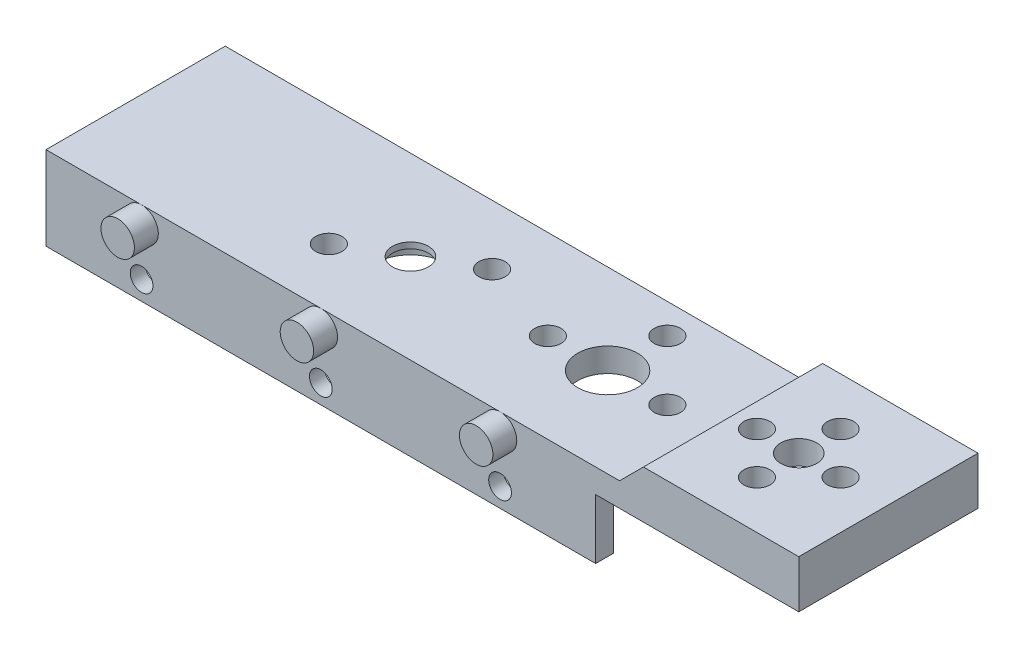
from build123d import *

# Parameters (mm, degrees)
SKETCH_1_W          = 63
SKETCH_1_H          = 15
SKETCH_1_R          = 1.1
SKETCH_1_R_2        = 1.5
SKETCH_1_R_3        = 2.5
EXTRUDE_1_DEPTH     = 2
SKETCH_2_R          = 1.4
EXTRUDE_2_DEPTH     = 2
SKETCH_3_R          = 3
CUT_EXTRUDE_1_DEPTH = 1.5
SKETCH_4_W          = 46
SKETCH_4_H          = 1.5
EXTRUDE_3_DEPTH     = 5
SKETCH_2_3_R        = 0.95
CUT_EXTRUDE_2_DEPTH = 1.5
CUT_EXTRUDE_3_DEPTH = 0.25
SKETCH_1_7_W        = 15
SKETCH_1_7_H        = 15
SKETCH_1_7_R        = 1.5
SKETCH_1_7_R_2      = 1.1
EXTRUDE_4_DEPTH     = 4
SKETCH_1_8_R        = 6
SKETCH_1_8_R_2      = 1.5
SKETCH_1_8_R_3      = 1.1
CUT_EXTRUDE_4_DEPTH = 2
CUT_EXTRUDE_5_DEPTH = 15


with BuildPart() as part:
    # 草图1 → 凸台-拉伸1 (new body)
    with BuildSketch(Plane(origin=(0, 0, 0), x_dir=(1, 0, 0), z_dir=(0, 1, 0))):
        Rectangle(SKETCH_1_W, SKETCH_1_H)
        with Locations(Location((-12.830127019, -2.5, 0), (0, 0, 270))):
            Circle(SKETCH_1_R, mode=Mode.SUBTRACT)
        with Locations(Location((3, 0, 0), (0, 0, 270))):
            Circle(SKETCH_1_R, mode=Mode.SUBTRACT)
        with Locations(Location((-8.5, 0, 0), (0, 0, 270))):
            Circle(SKETCH_1_R_2, mode=Mode.SUBTRACT)
        with Locations(Location((-4.169872981, 2.5, 0), (0, 0, 270))):
            Circle(SKETCH_1_R, mode=Mode.SUBTRACT)
        with Locations(Location((8, 0, 0), (0, 0, 270))):
            Circle(SKETCH_1_R_3, mode=Mode.SUBTRACT)
        with Locations(Location((13, 0, 0), (0, 0, 270))):
            Circle(SKETCH_1_R, mode=Mode.SUBTRACT)
        with Locations(Location((8, 5, 0), (0, 0, 270))):
            Circle(SKETCH_1_R, mode=Mode.SUBTRACT)
        with Locations(Location((24, 3.5, 0), (0, 0, 270))):
            Circle(SKETCH_1_R, mode=Mode.SUBTRACT)
        with Locations(Location((24, -3.5, 0), (0, 0, 270))):
            Circle(SKETCH_1_R, mode=Mode.SUBTRACT)
        with Locations(Location((20.5, 0, 0), (0, 0, 270))):
            Circle(SKETCH_1_R, mode=Mode.SUBTRACT)
        with Locations(Location((24, 0, 0), (0, 0, 270))):
            Circle(SKETCH_1_R_2, mode=Mode.SUBTRACT)
        with Locations(Location((27.5, 0, 0), (0, 0, 270))):
            Circle(SKETCH_1_R, mode=Mode.SUBTRACT)
    extrude(amount=EXTRUDE_1_DEPTH)

    # 草图2 → 凸台-拉伸2 (add)
    with BuildSketch(Plane.XY.offset(7.5)):
        with Locations(Location((-23.5, 0.6, 0), (0, 0, 205.376933525))):
            Circle(SKETCH_2_R)
        with Locations(Location((-8.5, 0.6, 0), (0, 0, 205.376933525))):
            Circle(SKETCH_2_R)
        with Locations(Location((6.5, 0.6, 0), (0, 0, 205.376933525))):
            Circle(SKETCH_2_R)
    extrude(amount=EXTRUDE_2_DEPTH)

    # 草图3 → 切除-拉伸1 (cut)
    with BuildSketch(Plane.XZ):
        with Locations(Location((-8.5, 0, 0), (0, 0, 270))):
            Circle(SKETCH_3_R)
    extrude(amount=-CUT_EXTRUDE_1_DEPTH, mode=Mode.SUBTRACT)

    # 草图4 → 凸台-拉伸3 (add)
    with BuildSketch(Plane.XZ):
        with Locations((-8.5, 6.75)):
            Rectangle(SKETCH_4_W, SKETCH_4_H)
    extrude(amount=EXTRUDE_3_DEPTH)

    # 草图2<3> → 切除-拉伸2 (cut)
    with BuildSketch(Plane.XY.offset(7.5)):
        with Locations((-23.5, -3.4)):
            Circle(SKETCH_2_3_R)
        with Locations((-8.5, -3.4)):
            Circle(SKETCH_2_3_R)
        with Locations((6.5, -3.4)):
            Circle(SKETCH_2_3_R)
    extrude(amount=-CUT_EXTRUDE_2_DEPTH, mode=Mode.SUBTRACT)

    # 草图5 → 切除-拉伸3 (cut)
    with BuildSketch(Plane(origin=(0, 0, 6), x_dir=(-1, 0, 0), z_dir=(0, 0, -1))):
        Polygon((22.403034489, -1.5), (24.596965511, -1.5), (25.693931023, -3.4), (24.596965511, -5.3), (22.403034489, -5.3), (21.306068977, -3.4), align=None)
        Polygon((6.306068977, -3.4), (7.403034489, -1.5), (9.596965511, -1.5), (10.693931023, -3.4), (9.596965511, -5.3), (7.403034489, -5.3), align=None)
        Polygon((-8.693931023, -3.4), (-7.596965511, -1.5), (-5.403034489, -1.5), (-4.306068977, -3.4), (-5.403034489, -5.3), (-7.596965511, -5.3), align=None)
    extrude(amount=-CUT_EXTRUDE_3_DEPTH, mode=Mode.SUBTRACT)

    # 草图1<7> → 凸台-拉伸4 (add)
    with BuildSketch(Plane(origin=(0, 0, 0), x_dir=(1, 0, 0), z_dir=(0, 1, 0))):
        with Locations((24, 0)):
            Rectangle(SKETCH_1_7_W, SKETCH_1_7_H)
        with Locations(Location((24, 0, 0), (0, 0, 270))):
            Circle(SKETCH_1_7_R, mode=Mode.SUBTRACT)
        with Locations(Location((27.5, 0, 0), (0, 0, 270))):
            Circle(SKETCH_1_7_R_2, mode=Mode.SUBTRACT)
        with Locations(Location((24, -3.5, 0), (0, 0, 270))):
            Circle(SKETCH_1_7_R_2, mode=Mode.SUBTRACT)
        with Locations(Location((20.5, 0, 0), (0, 0, 270))):
            Circle(SKETCH_1_7_R_2, mode=Mode.SUBTRACT)
        with Locations(Location((24, 3.5, 0), (0, 0, 270))):
            Circle(SKETCH_1_7_R_2, mode=Mode.SUBTRACT)
    extrude(amount=EXTRUDE_4_DEPTH)

    # 草图1<8> → 切除-拉伸4 (cut)
    with BuildSketch(Plane(origin=(0, 0, 0), x_dir=(1, 0, 0), z_dir=(0, 1, 0))):
        with Locations(Location((24, 0, 0), (0, 0, 270))):
            Circle(SKETCH_1_8_R)
        with Locations(Location((24, 0, 0), (0, 0, 270))):
            Circle(SKETCH_1_8_R_2, mode=Mode.SUBTRACT)
        with Locations(Location((27.5, 0, 0), (0, 0, 270))):
            Circle(SKETCH_1_8_R_3, mode=Mode.SUBTRACT)
        with Locations(Location((24, -3.5, 0), (0, 0, 270))):
            Circle(SKETCH_1_8_R_3, mode=Mode.SUBTRACT)
        with Locations(Location((20.5, 0, 0), (0, 0, 270))):
            Circle(SKETCH_1_8_R_3, mode=Mode.SUBTRACT)
        with Locations(Location((24, 3.5, 0), (0, 0, 270))):
            Circle(SKETCH_1_8_R_3, mode=Mode.SUBTRACT)
    extrude(amount=CUT_EXTRUDE_4_DEPTH, mode=Mode.SUBTRACT)

    # 草图6 → 切除-拉伸5 (cut)
    with BuildSketch(Plane(origin=(0, 0, -7.5), x_dir=(-1, 0, 0), z_dir=(0, 0, -1))):
        Polygon((-16.5, 2), (-18.5, 4), (-16.5, 4), align=None)
    extrude(amount=-CUT_EXTRUDE_5_DEPTH, mode=Mode.SUBTRACT)


solid = part.part
